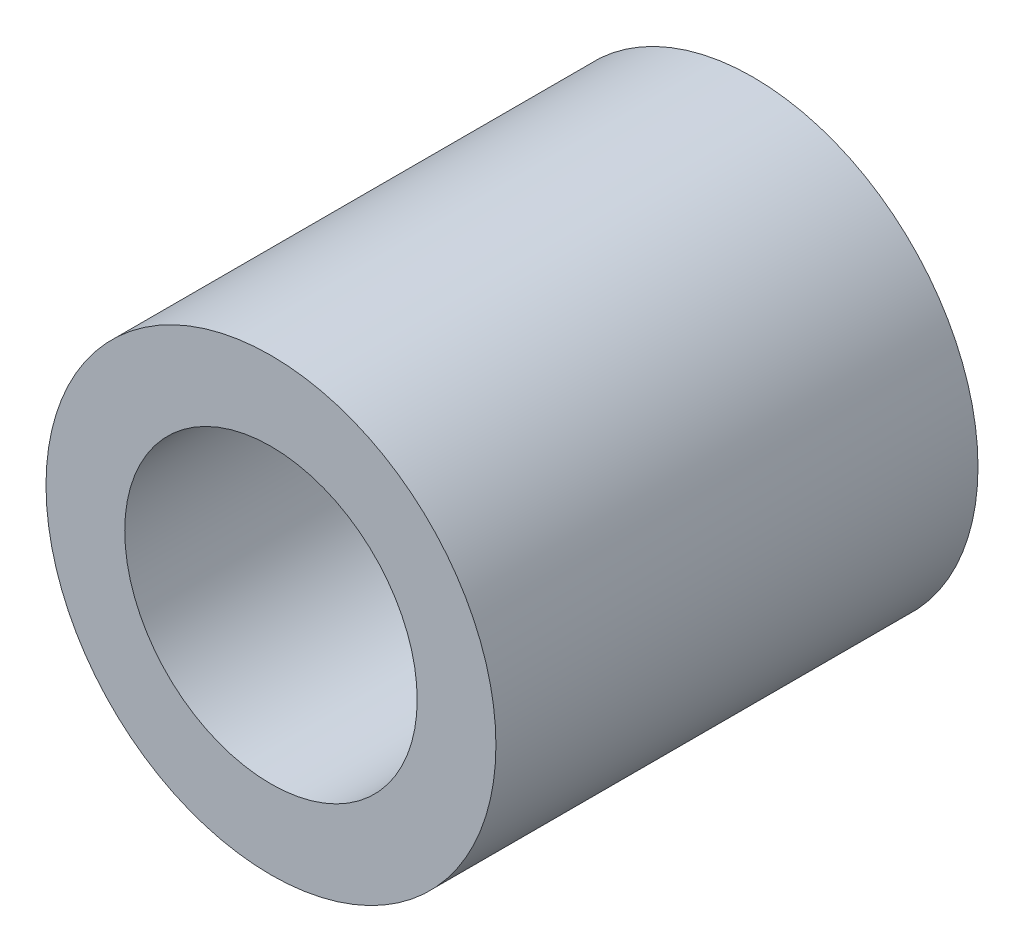
from build123d import *

# Parameters (mm, degrees)
SKETCH1_R           = 10.668
SKETCH1_R_2         = 6.9342
BOSS_EXTRUDE1_DEPTH = 22.86


with BuildPart() as part:
    # Sketch1 → Boss-Extrude1 (new body)
    with BuildSketch(Plane.XY):
        Circle(SKETCH1_R)
        Circle(SKETCH1_R_2, mode=Mode.SUBTRACT)
    extrude(amount=BOSS_EXTRUDE1_DEPTH)


solid = part.part
